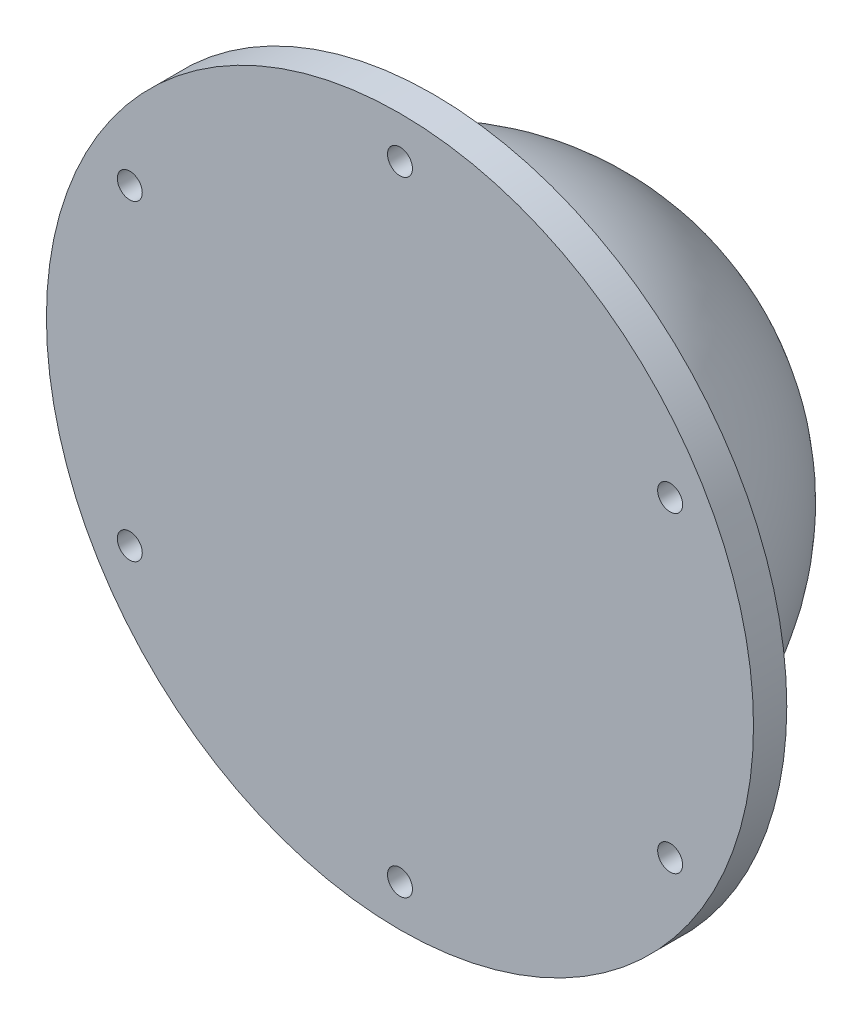
from build123d import *

# Parameters (mm, degrees)
SKETCH_1_R      = 85
SKETCH_1_R_2    = 3
EXTRUDE_1_DEPTH = 8


with BuildPart() as part:
    # 草图1 → 凸台-拉伸1 (new body)
    with BuildSketch(Plane.XY):
        Circle(SKETCH_1_R)
        with Locations((0, 75)):
            Circle(SKETCH_1_R_2, mode=Mode.SUBTRACT)
        with Locations((64.951905284, 37.5)):
            Circle(SKETCH_1_R_2, mode=Mode.SUBTRACT)
        with Locations((64.951905284, -37.5)):
            Circle(SKETCH_1_R_2, mode=Mode.SUBTRACT)
        with Locations((0, -75)):
            Circle(SKETCH_1_R_2, mode=Mode.SUBTRACT)
        with Locations((-64.951905284, -37.5)):
            Circle(SKETCH_1_R_2, mode=Mode.SUBTRACT)
        with Locations((-64.951905284, 37.5)):
            Circle(SKETCH_1_R_2, mode=Mode.SUBTRACT)
    extrude(amount=EXTRUDE_1_DEPTH)

    # 草图2 → 旋转1 (revolve)
    with BuildSketch(Plane(origin=(0, 0, 0), x_dir=(1, 0, 0), z_dir=(0, 1, 0)), mode=Mode.PRIVATE) as revolve_1_sk:
        with BuildLine():
            Line((-60, 0), (-65, 0))
            ThreePointArc((-65, 0), (-45.961940777, 45.961940777), (0, 65))
            Line((0, 65), (0, 60))
            ThreePointArc((0, 60), (-42.426406871, 42.426406871), (-60, 0))
        make_face()
    revolve(revolve_1_sk.sketch.rotate(Axis((0, 0, -60), (0, 0, -1)), 180), axis=Axis((0, 0, -60), (0, 0, -1)))


solid = part.part
